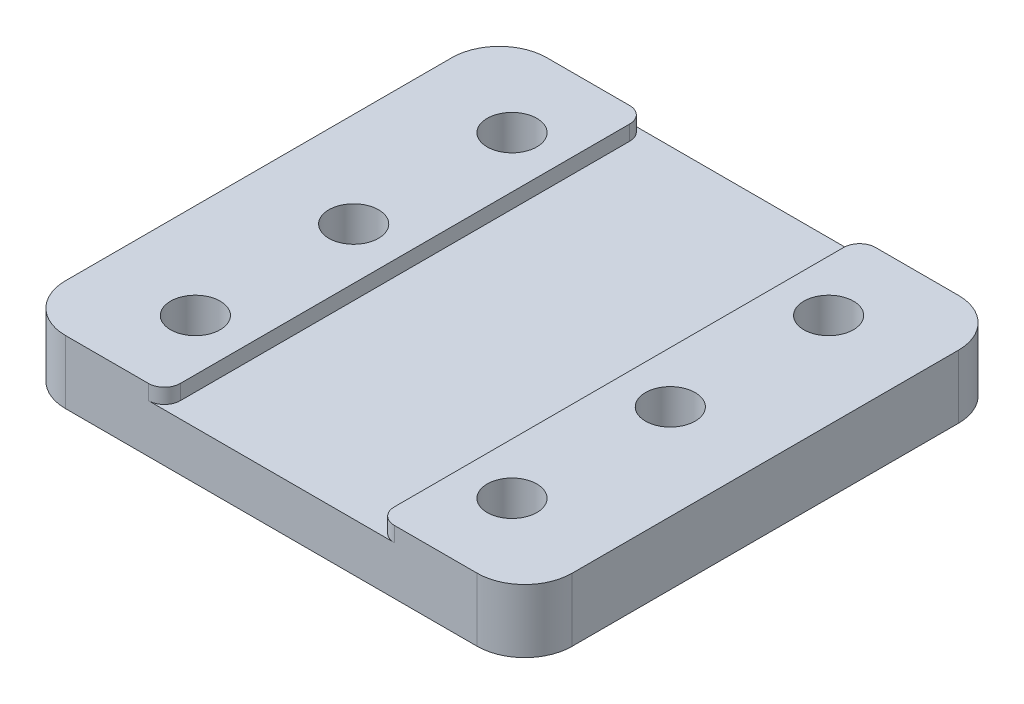
from build123d import *

# Parameters (mm, degrees)
SKETCH1_W           = 50.8
SKETCH1_H           = 48.26
SKETCH1_R           = 2.4892
BOSS_EXTRUDE1_DEPTH = 3.175
FILLET1_R           = 4.7625
SKETCH3_W           = 21.450000026
SKETCH3_H           = 48.26
CUT_EXTRUDE2_DEPTH  = 1.499999794
FILLET2_R           = 1.600000102


with BuildPart() as part:
    # Sketch1 → Boss-Extrude1 (new, symmetric)
    with BuildSketch(Plane(origin=(0, 0, 0), x_dir=(1, 0, 0), z_dir=(0, 1, 0))):
        with Locations((25.4, 24.13)):
            Rectangle(SKETCH1_W, SKETCH1_H)
        with Locations(Location((9.525, 8.255, 0), (0, 0, 270))):
            Circle(SKETCH1_R, mode=Mode.SUBTRACT)
        with Locations(Location((9.525, 24.13, 0), (0, 0, 270))):
            Circle(SKETCH1_R, mode=Mode.SUBTRACT)
        with Locations(Location((9.525, 40.005, 0), (0, 0, 270))):
            Circle(SKETCH1_R, mode=Mode.SUBTRACT)
        with Locations(Location((41.275, 24.13, 0), (0, 0, 270))):
            Circle(SKETCH1_R, mode=Mode.SUBTRACT)
        with Locations(Location((41.275, 40.005, 0), (0, 0, 270))):
            Circle(SKETCH1_R, mode=Mode.SUBTRACT)
        with Locations(Location((41.275, 8.255, 0), (0, 0, 270))):
            Circle(SKETCH1_R, mode=Mode.SUBTRACT)
    extrude(amount=BOSS_EXTRUDE1_DEPTH, both=True)

    # Fillet1
    fillet1_edges = [part.edges().sort_by_distance(p)[0] for p in [
        (0, 0, 0),
        (0, 0, -48.26),
        (50.8, 0, -48.26),
        (50.8, 0, 0),
    ]]
    fillet(fillet1_edges, radius=FILLET1_R)

    # Sketch3 → Cut-Extrude2 (cut)
    with BuildSketch(Plane(origin=(0, 3.175, 0), x_dir=(1, 0, 0), z_dir=(0, 1, 0))):
        with Locations((25.4, 24.13)):
            Rectangle(SKETCH3_W, SKETCH3_H)
    extrude(amount=-CUT_EXTRUDE2_DEPTH, mode=Mode.SUBTRACT)

    # Fillet2
    fillet2_edges = [part.edges().sort_by_distance(p)[0] for p in [
        (14.674999987, 2.425000103, 0),
        (14.674999987, 2.425000103, -48.26),
        (36.125000013, 2.425000103, -48.26),
        (36.125000013, 2.425000103, 0),
    ]]
    fillet(fillet2_edges, radius=FILLET2_R)


solid = part.part
